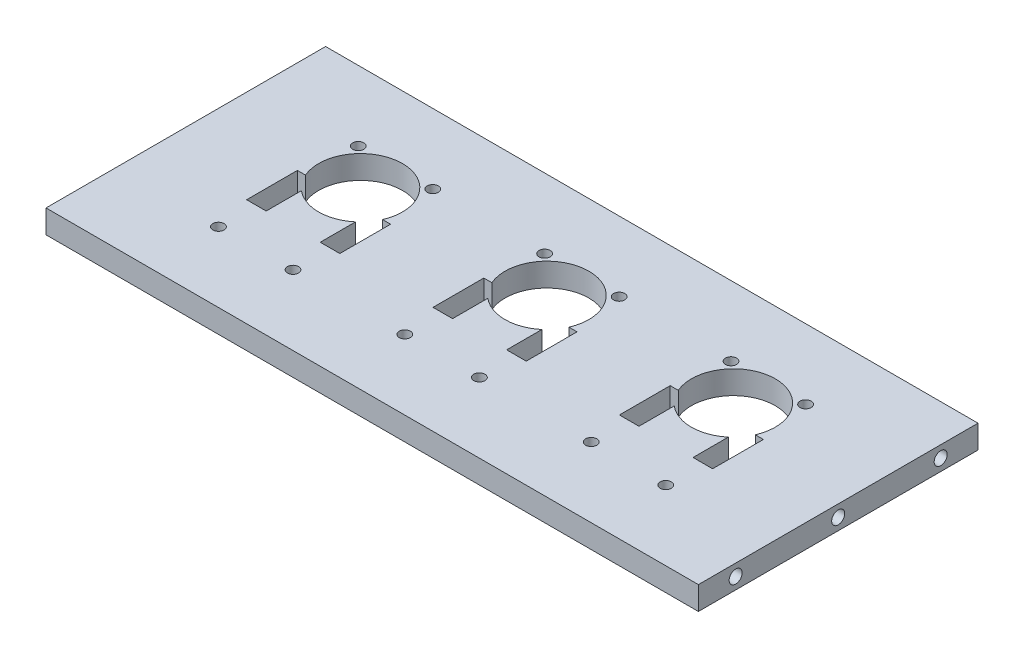
from build123d import *

# Parameters (mm, degrees)
SKETCH_1_W             = 140
SKETCH_1_H             = 60
EXTRUDE_1_DEPTH        = 5
SKETCH_2_R             = 1.2
CUT_EXTRUDE_1096_DEPTH = 153.397506541
SKETCH_4_R             = 1.4
CUT_EXTRUDE_3_DEPTH    = 5
PATTERN_LINEAR_1_COUNT = 3
PATTERN_LINEAR_1_PITCH = 40
SKETCH_6_R             = 2
CUT_EXTRUDE_4_DEPTH    = 1


with BuildPart() as part:
    # 草图1 → 凸台-拉伸1 (new body)
    with BuildSketch(Plane(origin=(0, 0, 0), x_dir=(1, 0, 0), z_dir=(0, 1, 0))):
        with Locations((70, -30)):
            Rectangle(SKETCH_1_W, SKETCH_1_H)
    extrude(amount=EXTRUDE_1_DEPTH)

    # 草图2 → Cut-Extrude 1096 (cut, through all)
    with BuildSketch(Plane(origin=(0, 5, 0), x_dir=(1, 0, 0), z_dir=(0, 1, 0))):
        with Locations((102, -15)):
            Circle(SKETCH_2_R)
        with Locations((118, -15)):
            Circle(SKETCH_2_R)
        with Locations((102, -45)):
            Circle(SKETCH_2_R)
        with Locations((118, -45)):
            Circle(SKETCH_2_R)
        with BuildLine():
            Line((100, -26.05), (100, -36.95))
            Line((100, -36.95), (104.2, -36.95))
            Line((104.2, -36.95), (104.2, -29.381860214))
            ThreePointArc((104.2, -29.381860214), (110, -31.5), (115.8, -29.381860214))
            Line((115.8, -29.381860214), (115.8, -36.95))
            Line((115.8, -36.95), (120, -36.95))
            Line((120, -36.95), (120, -26.05))
            Line((120, -26.05), (118.270278109, -26.05))
            ThreePointArc((118.270278109, -26.05), (110, -13.5), (101.729721891, -26.05))
            Line((101.729721891, -26.05), (100, -26.05))
        make_face()
    cut_extrude_1096 = extrude(amount=-CUT_EXTRUDE_1096_DEPTH, mode=Mode.SUBTRACT)

    # 草图4 → 切除-拉伸3 (cut)
    with BuildSketch(Plane.ZY):
        with Locations((30, 2.5)):
            Circle(SKETCH_4_R)
        with Locations((8, 2.5)):
            Circle(SKETCH_4_R)
        with Locations((52, 2.5)):
            Circle(SKETCH_4_R)
    cut_extrude_3 = extrude(amount=-CUT_EXTRUDE_3_DEPTH, mode=Mode.SUBTRACT)

    # 镜向1: 切除-拉伸3 across plane
    add(cut_extrude_3.mirror(Plane(origin=(70, 0, 0), x_dir=(0, 0, 1), z_dir=(1, 0, 0))), mode=Mode.SUBTRACT)

    # 阵列(线性)1: Cut-Extrude 1096 ×3
    with Locations(*[(-i * PATTERN_LINEAR_1_PITCH, 0, 0) for i in range(1, PATTERN_LINEAR_1_COUNT)]):
        add(cut_extrude_1096, mode=Mode.SUBTRACT)

    # 草图6 → 切除-拉伸4 (cut)
    with BuildSketch(Plane.XZ):
        with Locations((22, 45)):
            Circle(SKETCH_6_R)
        with Locations((38, 45)):
            Circle(SKETCH_6_R)
        with Locations((62, 45)):
            Circle(SKETCH_6_R)
        with Locations((78, 45)):
            Circle(SKETCH_6_R)
        with Locations((102, 45)):
            Circle(SKETCH_6_R)
        with Locations((118, 45)):
            Circle(SKETCH_6_R)
    extrude(amount=-CUT_EXTRUDE_4_DEPTH, mode=Mode.SUBTRACT)


solid = part.part
